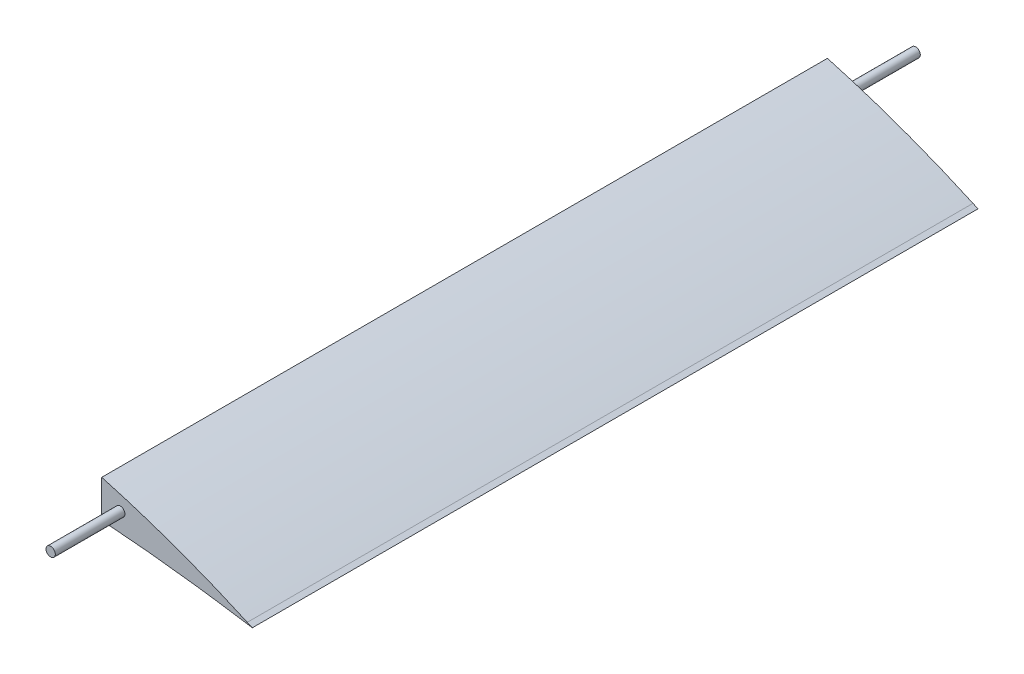
from build123d import *

# Parameters (mm, degrees)
BOSS_EXTRUDE1_DEPTH = 156.25
SKETCH2_R           = 2
BOSS_EXTRUDE2_DEPTH = 30


with BuildPart() as part:
    # Sketch1 → Boss-Extrude1 (new, symmetric)
    with BuildSketch(Plane.XY):
        with BuildLine():
            Line((250.0905, 0.30175), (252.249073162, -0.674460576))
            Line((252.249073162, -0.674460576), (249.9095, -0.30175))
            add(Edge.make_bspline(
                [(187.409499992, 6.97162784), (187.926542579, 6.93467422), (191.182721922, 6.698224302), (197.036321835, 6.230878489), (204.808324469, 5.519375072), (212.104795112, 4.771105754), (218.875568902, 4.008381966), (225.073163798, 3.252618397), (230.65359628, 2.526708522), (235.57661183, 1.850436242), (239.806204059, 1.243618912), (243.311102366, 0.722290418), (246.065118996, 0.301639985), (248.047511403, -0.006998185), (249.243010727, -0.195573538), (249.776002712, -0.280482936), (249.9095, -0.30175)],
                knots=[0.879031338, 0.879031338, 0.879031338, 0.879031338, 0.882020077, 0.897855052, 0.912888481, 0.927018156, 0.940144762, 0.952173577, 0.963016384, 0.97259107, 0.980824956, 0.987652854, 0.993021794, 0.996888135, 0.999220578, 1, 1, 1, 1], degree=3))
            Line((187.409499992, 6.97162784), (187.409499992, 23.031618348))
            add(Edge.make_bspline(
                [(250.0905, 0.30175), (249.967176894, 0.357522638), (249.474705499, 0.580241883), (248.368757841, 1.077478413), (246.531056029, 1.895578453), (243.970022782, 3.018717316), (240.697484766, 4.425321678), (236.728718064, 6.08814206), (232.083205178, 7.976570158), (226.783347758, 10.054370405), (220.856263164, 12.28446326), (214.332179959, 14.625376483), (207.245873814, 17.035839108), (199.635416935, 19.472597931), (192.963027463, 21.469209577), (188.829830843, 22.637983802), (187.409499992, 23.031618348)],
                knots=[0, 0, 0, 0, 0.000780389, 0.003116359, 0.00699149, 0.012378647, 0.019240165, 0.027529116, 0.037188568, 0.048153015, 0.060350466, 0.073700476, 0.088115901, 0.103505481, 0.119772438, 0.128270281, 0.128270281, 0.128270281, 0.128270281], degree=3))
        make_face()
    extrude(amount=BOSS_EXTRUDE1_DEPTH, both=True)

    # Sketch2 → Boss-Extrude2 (add)
    with BuildSketch(Plane.XY.offset(156.25)):
        with Locations(Location((195.409499992, 14.325539424, 0), (0, 0, 180))):
            Circle(SKETCH2_R)
    boss_extrude2 = extrude(amount=BOSS_EXTRUDE2_DEPTH)

    # Mirror1: Boss-Extrude2 across plane
    add(boss_extrude2.mirror(Plane.XY))


solid = part.part
